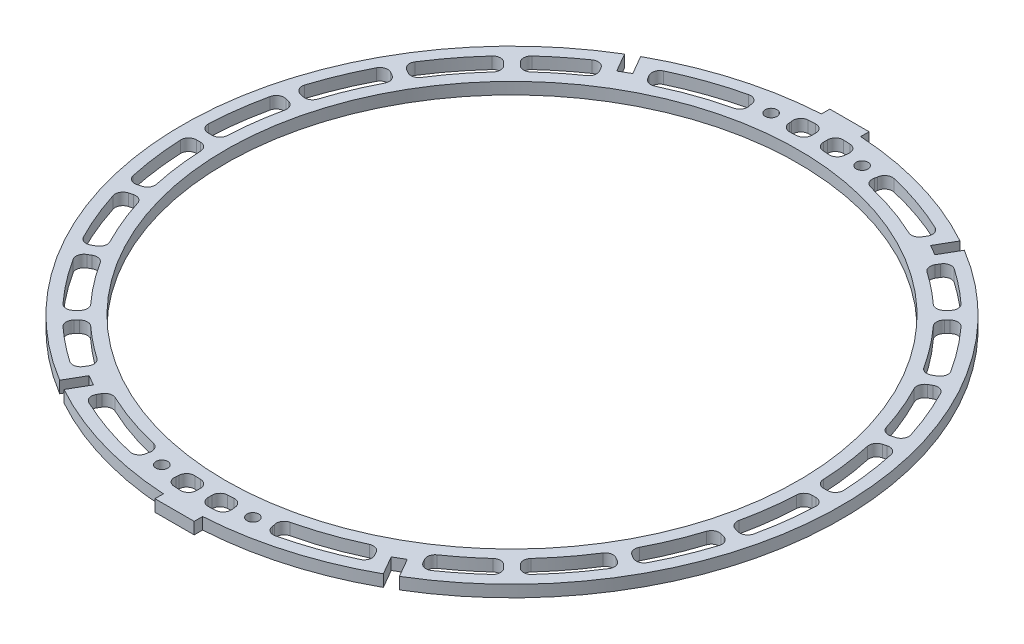
from build123d import *

# Parameters (mm, degrees)
SKETCH1_R            = 73
BOSS_EXTRUDE1_DEPTH  = 3
SKETCH2_R            = 1.5
CUT_EXTRUDE1_DEPTH   = 3
CUT_EXTRUDE2_DEPTH   = 3
MIRROR2_COPY_1_DEPTH = 3
MIRROR2_COPY_2_DEPTH = 3


with BuildPart() as part:
    # Sketch1 → Boss-Extrude1 (new body)
    with BuildSketch(Plane(origin=(0, 0, 0), x_dir=(1, 0, 0), z_dir=(0, 1, 0))):
        with BuildLine():
            Line((-37.950961894, 68.732994197), (-40.549038106, 67.232994197))
            Line((-40.549038106, 67.232994197), (-43.292341143, 71.984534439))
            ThreePointArc((-43.292341143, 71.984534439), (-84, 0), (-43.292341143, -71.984534439))
            Line((-43.292341143, -71.984534439), (-40.549038106, -67.232994197))
            Line((-40.549038106, -67.232994197), (-37.950961894, -68.732994197))
            Line((-37.950961894, -68.732994197), (-40.694264932, -73.484534439))
            ThreePointArc((-40.694264932, -73.484534439), (-23.427711515, -80.666860192), (-5, -83.851058431))
            Line((-5, -83.851058431), (-5, -86))
            Line((-5, -86), (5, -86))
            Line((5, -86), (5, -83.851058431))
            ThreePointArc((5, -83.851058431), (23.427711515, -80.666860192), (40.694264932, -73.484534439))
            Line((40.694264932, -73.484534439), (37.950961894, -68.732994197))
            Line((37.950961894, -68.732994197), (40.549038106, -67.232994197))
            Line((40.549038106, -67.232994197), (43.292341143, -71.984534439))
            ThreePointArc((43.292341143, -71.984534439), (84, 0), (43.292341143, 71.984534439))
            Line((43.292341143, 71.984534439), (40.549038106, 67.232994197))
            Line((40.549038106, 67.232994197), (37.950961894, 68.732994197))
            Line((37.950961894, 68.732994197), (40.694264932, 73.484534439))
            ThreePointArc((40.694264932, 73.484534439), (23.427711515, 80.666860192), (5, 83.851058431))
            Line((5, 83.851058431), (5, 86))
            Line((5, 86), (-5, 86))
            Line((-5, 86), (-5, 83.851058431))
            ThreePointArc((-5, 83.851058431), (-23.427711515, 80.666860192), (-40.694264932, 73.484534439))
            Line((-40.694264932, 73.484534439), (-37.950961894, 68.732994197))
        make_face()
        Circle(SKETCH1_R, mode=Mode.SUBTRACT)
    extrude(amount=BOSS_EXTRUDE1_DEPTH)

    # Sketch2 → Cut-Extrude1 (cut)
    with BuildSketch(Plane(origin=(0, 3, 0), x_dir=(1, 0, 0), z_dir=(0, 1, 0))):
        with Locations((11.603038774, 77.637745274)):
            Circle(SKETCH2_R)
        with Locations((-11.603038774, -77.637745274)):
            Circle(SKETCH2_R)
        with Locations((-11.603038774, 77.637745274)):
            Circle(SKETCH2_R)
        with Locations((11.603038774, -77.637745274)):
            Circle(SKETCH2_R)
    extrude(amount=-CUT_EXTRUDE1_DEPTH, mode=Mode.SUBTRACT)

    # Sketch3 → Cut-Extrude2 (cut)
    with BuildSketch(Plane(origin=(0, 3, 0), x_dir=(1, 0, 0), z_dir=(0, 1, 0))):
        with BuildLine():
            ThreePointArc((67.456764028, 35.008355957), (70.214844471, 29.08394086), (72.453781177, 22.944489386))
            ThreePointArc((72.453781177, 22.944489386), (73.399581376, 21.794235586), (74.878097719, 21.616440085))
            Line((74.878097719, 21.616440085), (75.844985105, 21.87551678))
            ThreePointArc((75.844985105, 21.87551678), (77.081129936, 22.845991572), (77.234368459, 24.41008662))
            ThreePointArc((77.234368459, 24.41008662), (74.834242133, 30.997358022), (71.873483456, 37.352407899))
            ThreePointArc((71.873483456, 37.352407899), (70.659145243, 38.350034116), (69.098829544, 38.16217703))
            Line((69.098829544, 38.16217703), (68.231942029, 37.66167929))
            ThreePointArc((68.231942029, 37.66167929), (67.312193501, 36.490489953), (67.456764028, 35.008355957))
        make_face()
        with BuildLine():
            ThreePointArc((56.097401273, 51.274570407), (60.294853862, 46.265868605), (64.046507618, 40.915093327))
            ThreePointArc((64.046507618, 40.915093327), (65.257788046, 40.04882458), (66.731942029, 40.259755502))
            Line((66.731942029, 40.259755502), (67.598829544, 40.760253242))
            ThreePointArc((67.598829544, 40.760253242), (68.541676401, 42.017597732), (68.284875861, 43.568058582))
            ThreePointArc((68.284875861, 43.568058582), (64.261620564, 49.30967575), (59.756939351, 54.68188182))
            ThreePointArc((59.756939351, 54.68188182), (58.325774044, 55.331220891), (56.867245805, 54.745925461))
            Line((56.867245805, 54.745925461), (56.159435113, 54.038114769))
            ThreePointArc((56.159435113, 54.038114769), (55.574152362, 52.668784305), (56.097401273, 51.274570407))
        make_face()
        with BuildLine():
            ThreePointArc((43.352653244, 62.422331394), (47.419184401, 59.392095019), (51.274570407, 56.097401273))
            ThreePointArc((51.274570407, 56.097401273), (52.668784305, 55.574152362), (54.038114769, 56.159435113))
            Line((54.038114769, 56.159435113), (54.745925461, 56.867245805))
            ThreePointArc((54.745925461, 56.867245805), (55.331220891, 58.325774044), (54.68188182, 59.756939351))
            ThreePointArc((54.68188182, 59.756939351), (50.523360082, 63.311847912), (46.134355428, 66.577933651))
            ThreePointArc((46.134355428, 66.577933651), (44.557578778, 66.88556078), (43.263184733, 65.934034055))
            Line((43.263184733, 65.934034055), (42.761461732, 65.065024326))
            ThreePointArc((42.761461732, 65.065024326), (42.541754461, 63.628400458), (43.352653244, 62.422331394))
        make_face()
        with BuildLine():
            ThreePointArc((32.382998129, 68.755664728), (33.832933968, 68.656440314), (34.967233098, 69.565024326))
            Line((34.967233098, 69.565024326), (35.468956099, 70.434034055))
            ThreePointArc((35.468956099, 70.434034055), (35.645805393, 72.030775543), (34.59100416, 73.242490613))
            ThreePointArc((34.59100416, 73.242490613), (26.70292251, 76.471915952), (18.519155056, 78.854555328))
            ThreePointArc((18.519155056, 78.854555328), (16.909980162, 78.542490797), (16.074552524, 77.132211118))
            ThreePointArc((16.074552524, 77.132211118), (16.022360501, 76.789455544), (15.943935082, 76.451735475))
            ThreePointArc((15.943935082, 76.451735475), (16.154160192, 74.902453014), (17.414934578, 73.977834881))
            ThreePointArc((17.414934578, 73.977834881), (25.035500609, 71.758091594), (32.382998129, 68.755664728))
        make_face()
        with BuildLine():
            ThreePointArc((1.5, 77.921434792), (2.054405455, 76.539314533), (3.41025641, 75.923449284))
            ThreePointArc((3.41025641, 75.923449284), (4.192871536, 75.884252835), (4.975040934, 75.836989443))
            ThreePointArc((4.975040934, 75.836989443), (6.451057655, 76.352591404), (7.105063282, 77.772713717))
            ThreePointArc((7.105063282, 77.772713717), (7.128804473, 78.118606398), (7.179105025, 78.461644654))
            ThreePointArc((7.179105025, 78.461644654), (6.792507475, 80.054557221), (5.34488471, 80.823463223))
            ThreePointArc((5.34488471, 80.823463223), (4.467009469, 80.876732293), (3.588607595, 80.920466481))
            ThreePointArc((3.588607595, 80.920466481), (2.117468841, 80.367631848), (1.5, 78.922430272))
            Line((1.5, 78.922430272), (1.5, 77.921434792))
        make_face()
        with BuildLine():
            ThreePointArc((75.923449284, 3.41025641), (76.539314533, 2.054405455), (77.921434792, 1.5))
            Line((77.921434792, 1.5), (78.922430272, 1.5))
            ThreePointArc((78.922430272, 1.5), (80.367631848, 2.117468841), (80.920466481, 3.588607595))
            ThreePointArc((80.920466481, 3.588607595), (80.307033771, 10.57262157), (79.09196844, 17.477429108))
            ThreePointArc((79.09196844, 17.477429108), (78.177212463, 18.755355892), (76.621442241, 18.977739301))
            Line((76.621442241, 18.977739301), (75.654554854, 18.718662606))
            ThreePointArc((75.654554854, 18.718662606), (74.463019892, 17.825429014), (74.219059792, 16.356379904))
            ThreePointArc((74.219059792, 16.356379904), (75.349809464, 9.919990609), (75.923449284, 3.41025641))
        make_face()
    cut_extrude2 = extrude(amount=-CUT_EXTRUDE2_DEPTH, mode=Mode.SUBTRACT)

    # Mirror1: Cut-Extrude2 across plane
    add(cut_extrude2.mirror(Plane(origin=(0, 0, 0), x_dir=(0, 0, 1), z_dir=(1, 0, 0))), mode=Mode.SUBTRACT)

    # Mirror2 copy 1 sketch → Mirror2 copy 1 (cut)
    with BuildSketch(Plane(origin=(0, 3, 0), x_dir=(-1, 0, 0), z_dir=(0, 1, 0))):
        with BuildLine():
            ThreePointArc((67.456764028, 35.008355957), (70.214844471, 29.08394086), (72.453781177, 22.944489386))
            ThreePointArc((72.453781177, 22.944489386), (73.399581376, 21.794235586), (74.878097719, 21.616440085))
            Line((74.878097719, 21.616440085), (75.844985105, 21.87551678))
            ThreePointArc((75.844985105, 21.87551678), (77.081129936, 22.845991572), (77.234368459, 24.41008662))
            ThreePointArc((77.234368459, 24.41008662), (74.834242133, 30.997358022), (71.873483456, 37.352407899))
            ThreePointArc((71.873483456, 37.352407899), (70.659145243, 38.350034116), (69.098829544, 38.16217703))
            Line((69.098829544, 38.16217703), (68.231942029, 37.66167929))
            ThreePointArc((68.231942029, 37.66167929), (67.312193501, 36.490489953), (67.456764028, 35.008355957))
        make_face()
        with BuildLine():
            ThreePointArc((56.097401273, 51.274570407), (60.294853862, 46.265868605), (64.046507618, 40.915093327))
            ThreePointArc((64.046507618, 40.915093327), (65.257788046, 40.04882458), (66.731942029, 40.259755502))
            Line((66.731942029, 40.259755502), (67.598829544, 40.760253242))
            ThreePointArc((67.598829544, 40.760253242), (68.541676401, 42.017597732), (68.284875861, 43.568058582))
            ThreePointArc((68.284875861, 43.568058582), (64.261620564, 49.30967575), (59.756939351, 54.68188182))
            ThreePointArc((59.756939351, 54.68188182), (58.325774044, 55.331220891), (56.867245805, 54.745925461))
            Line((56.867245805, 54.745925461), (56.159435113, 54.038114769))
            ThreePointArc((56.159435113, 54.038114769), (55.574152362, 52.668784305), (56.097401273, 51.274570407))
        make_face()
        with BuildLine():
            ThreePointArc((43.352653244, 62.422331394), (47.419184401, 59.392095019), (51.274570407, 56.097401273))
            ThreePointArc((51.274570407, 56.097401273), (52.668784305, 55.574152362), (54.038114769, 56.159435113))
            Line((54.038114769, 56.159435113), (54.745925461, 56.867245805))
            ThreePointArc((54.745925461, 56.867245805), (55.331220891, 58.325774044), (54.68188182, 59.756939351))
            ThreePointArc((54.68188182, 59.756939351), (50.523360082, 63.311847912), (46.134355428, 66.577933651))
            ThreePointArc((46.134355428, 66.577933651), (44.557578778, 66.88556078), (43.263184733, 65.934034055))
            Line((43.263184733, 65.934034055), (42.761461732, 65.065024326))
            ThreePointArc((42.761461732, 65.065024326), (42.541754461, 63.628400458), (43.352653244, 62.422331394))
        make_face()
        with BuildLine():
            ThreePointArc((32.382998129, 68.755664728), (33.832933968, 68.656440314), (34.967233098, 69.565024326))
            Line((34.967233098, 69.565024326), (35.468956099, 70.434034055))
            ThreePointArc((35.468956099, 70.434034055), (35.645805393, 72.030775543), (34.59100416, 73.242490613))
            ThreePointArc((34.59100416, 73.242490613), (26.70292251, 76.471915952), (18.519155056, 78.854555328))
            ThreePointArc((18.519155056, 78.854555328), (16.909980162, 78.542490797), (16.074552524, 77.132211118))
            ThreePointArc((16.074552524, 77.132211118), (16.022360501, 76.789455544), (15.943935082, 76.451735475))
            ThreePointArc((15.943935082, 76.451735475), (16.154160192, 74.902453014), (17.414934578, 73.977834881))
            ThreePointArc((17.414934578, 73.977834881), (25.035500609, 71.758091594), (32.382998129, 68.755664728))
        make_face()
        with BuildLine():
            ThreePointArc((1.5, 77.921434792), (2.054405455, 76.539314533), (3.41025641, 75.923449284))
            ThreePointArc((3.41025641, 75.923449284), (4.192871536, 75.884252835), (4.975040934, 75.836989443))
            ThreePointArc((4.975040934, 75.836989443), (6.451057655, 76.352591404), (7.105063282, 77.772713717))
            ThreePointArc((7.105063282, 77.772713717), (7.128804473, 78.118606398), (7.179105025, 78.461644654))
            ThreePointArc((7.179105025, 78.461644654), (6.792507475, 80.054557221), (5.34488471, 80.823463223))
            ThreePointArc((5.34488471, 80.823463223), (4.467009469, 80.876732293), (3.588607595, 80.920466481))
            ThreePointArc((3.588607595, 80.920466481), (2.117468841, 80.367631848), (1.5, 78.922430272))
            Line((1.5, 78.922430272), (1.5, 77.921434792))
        make_face()
        with BuildLine():
            ThreePointArc((75.923449284, 3.41025641), (76.539314533, 2.054405455), (77.921434792, 1.5))
            Line((77.921434792, 1.5), (78.922430272, 1.5))
            ThreePointArc((78.922430272, 1.5), (80.367631848, 2.117468841), (80.920466481, 3.588607595))
            ThreePointArc((80.920466481, 3.588607595), (80.307033771, 10.57262157), (79.09196844, 17.477429108))
            ThreePointArc((79.09196844, 17.477429108), (78.177212463, 18.755355892), (76.621442241, 18.977739301))
            Line((76.621442241, 18.977739301), (75.654554854, 18.718662606))
            ThreePointArc((75.654554854, 18.718662606), (74.463019892, 17.825429014), (74.219059792, 16.356379904))
            ThreePointArc((74.219059792, 16.356379904), (75.349809464, 9.919990609), (75.923449284, 3.41025641))
        make_face()
    extrude(amount=-MIRROR2_COPY_1_DEPTH, mode=Mode.SUBTRACT)

    # Mirror2 copy 2 sketch → Mirror2 copy 2 (cut)
    with BuildSketch(Plane(origin=(0, 3, 0), x_dir=(1, 0, 0), z_dir=(0, 1, 0))):
        with BuildLine():
            ThreePointArc((67.456764028, -35.008355957), (70.214844471, -29.08394086), (72.453781177, -22.944489386))
            ThreePointArc((72.453781177, -22.944489386), (73.399581376, -21.794235586), (74.878097719, -21.616440085))
            Line((74.878097719, -21.616440085), (75.844985105, -21.87551678))
            ThreePointArc((75.844985105, -21.87551678), (77.081129936, -22.845991572), (77.234368459, -24.41008662))
            ThreePointArc((77.234368459, -24.41008662), (74.834242133, -30.997358022), (71.873483456, -37.352407899))
            ThreePointArc((71.873483456, -37.352407899), (70.659145243, -38.350034116), (69.098829544, -38.16217703))
            Line((69.098829544, -38.16217703), (68.231942029, -37.66167929))
            ThreePointArc((68.231942029, -37.66167929), (67.312193501, -36.490489953), (67.456764028, -35.008355957))
        make_face()
        with BuildLine():
            ThreePointArc((56.097401273, -51.274570407), (60.294853862, -46.265868605), (64.046507618, -40.915093327))
            ThreePointArc((64.046507618, -40.915093327), (65.257788046, -40.04882458), (66.731942029, -40.259755502))
            Line((66.731942029, -40.259755502), (67.598829544, -40.760253242))
            ThreePointArc((67.598829544, -40.760253242), (68.541676401, -42.017597732), (68.284875861, -43.568058582))
            ThreePointArc((68.284875861, -43.568058582), (64.261620564, -49.30967575), (59.756939351, -54.68188182))
            ThreePointArc((59.756939351, -54.68188182), (58.325774044, -55.331220891), (56.867245805, -54.745925461))
            Line((56.867245805, -54.745925461), (56.159435113, -54.038114769))
            ThreePointArc((56.159435113, -54.038114769), (55.574152362, -52.668784305), (56.097401273, -51.274570407))
        make_face()
        with BuildLine():
            ThreePointArc((43.352653244, -62.422331394), (47.419184401, -59.392095019), (51.274570407, -56.097401273))
            ThreePointArc((51.274570407, -56.097401273), (52.668784305, -55.574152362), (54.038114769, -56.159435113))
            Line((54.038114769, -56.159435113), (54.745925461, -56.867245805))
            ThreePointArc((54.745925461, -56.867245805), (55.331220891, -58.325774044), (54.68188182, -59.756939351))
            ThreePointArc((54.68188182, -59.756939351), (50.523360082, -63.311847912), (46.134355428, -66.577933651))
            ThreePointArc((46.134355428, -66.577933651), (44.557578778, -66.88556078), (43.263184733, -65.934034055))
            Line((43.263184733, -65.934034055), (42.761461732, -65.065024326))
            ThreePointArc((42.761461732, -65.065024326), (42.541754461, -63.628400458), (43.352653244, -62.422331394))
        make_face()
        with BuildLine():
            ThreePointArc((32.382998129, -68.755664728), (33.832933968, -68.656440314), (34.967233098, -69.565024326))
            Line((34.967233098, -69.565024326), (35.468956099, -70.434034055))
            ThreePointArc((35.468956099, -70.434034055), (35.645805393, -72.030775543), (34.59100416, -73.242490613))
            ThreePointArc((34.59100416, -73.242490613), (26.70292251, -76.471915952), (18.519155056, -78.854555328))
            ThreePointArc((18.519155056, -78.854555328), (16.909980162, -78.542490797), (16.074552524, -77.132211118))
            ThreePointArc((16.074552524, -77.132211118), (16.022360501, -76.789455544), (15.943935082, -76.451735475))
            ThreePointArc((15.943935082, -76.451735475), (16.154160192, -74.902453014), (17.414934578, -73.977834881))
            ThreePointArc((17.414934578, -73.977834881), (25.035500609, -71.758091594), (32.382998129, -68.755664728))
        make_face()
        with BuildLine():
            ThreePointArc((1.5, -77.921434792), (2.054405455, -76.539314533), (3.41025641, -75.923449284))
            ThreePointArc((3.41025641, -75.923449284), (4.192871536, -75.884252835), (4.975040934, -75.836989443))
            ThreePointArc((4.975040934, -75.836989443), (6.451057655, -76.352591404), (7.105063282, -77.772713717))
            ThreePointArc((7.105063282, -77.772713717), (7.128804473, -78.118606398), (7.179105025, -78.461644654))
            ThreePointArc((7.179105025, -78.461644654), (6.792507475, -80.054557221), (5.34488471, -80.823463223))
            ThreePointArc((5.34488471, -80.823463223), (4.467009469, -80.876732293), (3.588607595, -80.920466481))
            ThreePointArc((3.588607595, -80.920466481), (2.117468841, -80.367631848), (1.5, -78.922430272))
            Line((1.5, -78.922430272), (1.5, -77.921434792))
        make_face()
        with BuildLine():
            ThreePointArc((75.923449284, -3.41025641), (76.539314533, -2.054405455), (77.921434792, -1.5))
            Line((77.921434792, -1.5), (78.922430272, -1.5))
            ThreePointArc((78.922430272, -1.5), (80.367631848, -2.117468841), (80.920466481, -3.588607595))
            ThreePointArc((80.920466481, -3.588607595), (80.307033771, -10.57262157), (79.09196844, -17.477429108))
            ThreePointArc((79.09196844, -17.477429108), (78.177212463, -18.755355892), (76.621442241, -18.977739301))
            Line((76.621442241, -18.977739301), (75.654554854, -18.718662606))
            ThreePointArc((75.654554854, -18.718662606), (74.463019892, -17.825429014), (74.219059792, -16.356379904))
            ThreePointArc((74.219059792, -16.356379904), (75.349809464, -9.919990609), (75.923449284, -3.41025641))
        make_face()
    extrude(amount=-MIRROR2_COPY_2_DEPTH, mode=Mode.SUBTRACT)


solid = part.part
